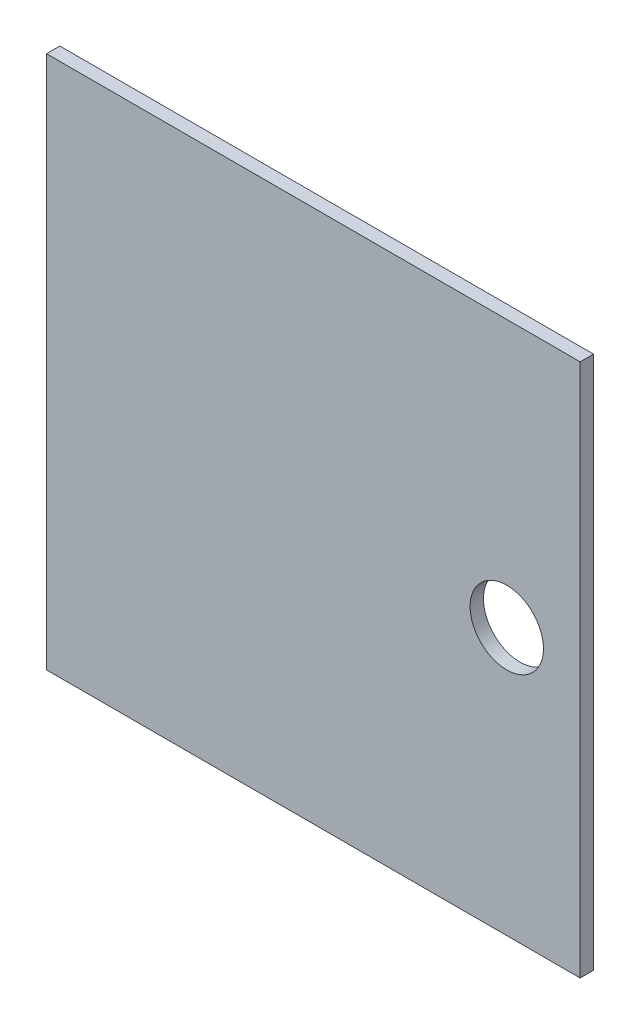
from build123d import *

# Parameters (mm, degrees)
SKETCH1_W           = 400
SKETCH1_H           = 400
BOSS_EXTRUDE1_DEPTH = 10
SKETCH4_R           = 27.5
CUT_EXTRUDE1_DEPTH  = 566.773806393


with BuildPart() as part:
    # Sketch1 → Boss-Extrude1 (new body)
    with BuildSketch(Plane.XY):
        with Locations((200, 200)):
            Rectangle(SKETCH1_W, SKETCH1_H)
    extrude(amount=BOSS_EXTRUDE1_DEPTH)

    # Sketch4 → Cut-Extrude1 (cut, through all)
    with BuildSketch(Plane.XY.offset(10)):
        with Locations((345.000168938, 199.966321147)):
            Circle(SKETCH4_R)
    extrude(amount=-CUT_EXTRUDE1_DEPTH, mode=Mode.SUBTRACT)


solid = part.part
